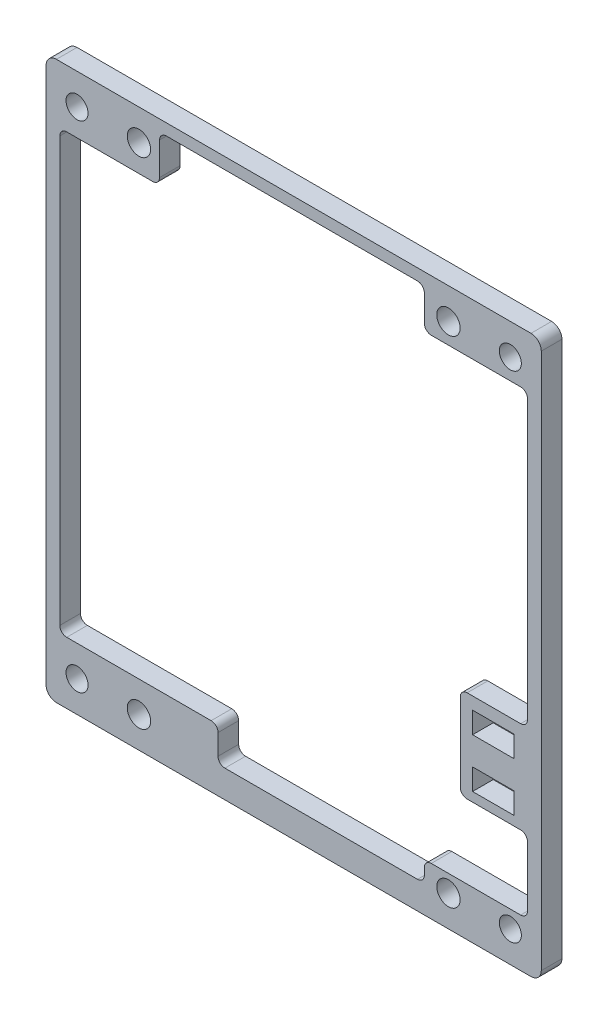
from build123d import *

# Parameters (mm, degrees)
MODEL_R                 = 1.7
MODEL_R_2               = 1.600279216
MODEL_W                 = 6
MODEL_H                 = 3.1
SALIENTE_EXTRUIR1_DEPTH = 3


with BuildPart() as part:
    # Model → Saliente-Extruir1 (new body)
    with BuildSketch(Plane.XY):
        with BuildLine():
            Line((76.985222791, 300.245724916), (7.982818557, 300.245724916))
            ThreePointArc((7.982818557, 300.245724916), (6.922158385, 299.806385087), (6.482818557, 298.745724916))
            Line((6.482818557, 298.745724916), (6.482818557, 220.741115058))
            ThreePointArc((6.482818557, 220.741115058), (6.922158385, 219.680454886), (7.982818557, 219.241115058))
            Line((7.982818557, 219.241115058), (76.985222791, 219.241115058))
            ThreePointArc((76.985222791, 219.241115058), (78.045882963, 219.680454886), (78.485222791, 220.741115058))
            Line((78.485222791, 220.741115058), (78.485222791, 298.745724916))
            ThreePointArc((78.485222791, 298.745724916), (78.045882963, 299.806385087), (76.985222791, 300.245724916))
        make_face()
        with Locations((19.982149553, 223.740780556)):
            Circle(MODEL_R, mode=Mode.SUBTRACT)
        with Locations((64.985557294, 223.740780556)):
            Circle(MODEL_R, mode=Mode.SUBTRACT)
        with Locations((10.982484055, 223.740780556)):
            Circle(MODEL_R_2, mode=Mode.SUBTRACT)
        with Locations((73.985222791, 223.740780556)):
            Circle(MODEL_R_2, mode=Mode.SUBTRACT)
        with Locations((19.982149553, 295.745724916)):
            Circle(MODEL_R, mode=Mode.SUBTRACT)
        with Locations((64.985557294, 295.745724916)):
            Circle(MODEL_R, mode=Mode.SUBTRACT)
        with Locations((73.985222791, 295.745724916)):
            Circle(MODEL_R_2, mode=Mode.SUBTRACT)
        with Locations((10.982484055, 295.745724916)):
            Circle(MODEL_R_2, mode=Mode.SUBTRACT)
        with BuildLine():
            Line((76.48504158, 291.747923326), (76.48504158, 251.338841953))
            ThreePointArc((76.48504158, 251.338841953), (76.192148361, 250.631735172), (75.48504158, 250.338841953))
            Line((75.48504158, 250.338841953), (67.705071812, 250.338841953))
            ThreePointArc((67.705071812, 250.338841953), (66.997954371, 250.045938075), (66.705071812, 249.338811805))
            Line((66.705071812, 249.338811805), (66.705414934, 237.957679154))
            ThreePointArc((66.705414934, 237.957679154), (66.998318811, 237.250591862), (67.705414933, 236.957709302))
            Line((67.705414933, 236.957709302), (75.48504158, 236.957709302))
            ThreePointArc((75.48504158, 236.957709302), (76.192148361, 236.664816083), (76.48504158, 235.957709302))
            Line((76.48504158, 235.957709302), (76.48504158, 227.243313469))
            ThreePointArc((76.48504158, 227.243313469), (76.192148361, 226.536206687), (75.48504158, 226.243313469))
            Line((75.48504158, 226.243313469), (62.48504158, 226.243313469))
            ThreePointArc((62.48504158, 226.243313469), (61.777934798, 225.95042025), (61.48504158, 225.243313469))
            Line((61.48504158, 225.243313469), (61.48504158, 224.241115058))
            ThreePointArc((61.48504158, 224.241115058), (61.192148361, 223.534008277), (60.48504158, 223.241115058))
            Line((60.48504158, 223.241115058), (32.482637345, 223.241115058))
            ThreePointArc((32.482637345, 223.241115058), (31.775530564, 223.534008277), (31.482637345, 224.241115058))
            Line((31.482637345, 224.241115058), (31.482637345, 227.21772226))
            ThreePointArc((31.482637345, 227.21772226), (31.189744126, 227.924829041), (30.482637345, 228.21772226))
            Line((30.482637345, 228.21772226), (9.482637345, 228.21772226))
            ThreePointArc((9.482637345, 228.21772226), (8.775530564, 228.510615479), (8.482637345, 229.21772226))
            Line((8.482637345, 229.21772226), (8.482637345, 290.857923326))
            ThreePointArc((8.482637345, 290.857923326), (8.775530564, 291.565030108), (9.482637345, 291.857923326))
            Line((9.482637345, 291.857923326), (21.982637345, 291.857923326))
            ThreePointArc((21.982637345, 291.857923326), (22.689744126, 292.150816545), (22.982637345, 292.857923326))
            Line((22.982637345, 292.857923326), (22.982637345, 297.584751174))
            ThreePointArc((22.982637345, 297.584751174), (23.275530564, 298.291857955), (23.982637345, 298.584751174))
            Line((23.982637345, 298.584751174), (60.48504158, 298.584751174))
            ThreePointArc((60.48504158, 298.584751174), (61.192148361, 298.291857955), (61.48504158, 297.584751174))
            Line((61.48504158, 297.584751174), (61.48504158, 293.747923326))
            ThreePointArc((61.48504158, 293.747923326), (61.777934798, 293.040816545), (62.48504158, 292.747923326))
            Line((62.48504158, 292.747923326), (75.48504158, 292.747923326))
            ThreePointArc((75.48504158, 292.747923326), (76.192148361, 292.455030108), (76.48504158, 291.747923326))
        make_face(mode=Mode.SUBTRACT)
        with Locations((71.494936084, 246.999441896)):
            Rectangle(MODEL_W, MODEL_H, mode=Mode.SUBTRACT)
        with Locations((71.494936084, 239.854068189)):
            Rectangle(MODEL_W, MODEL_H, mode=Mode.SUBTRACT)
    extrude(amount=SALIENTE_EXTRUIR1_DEPTH)


solid = part.part
